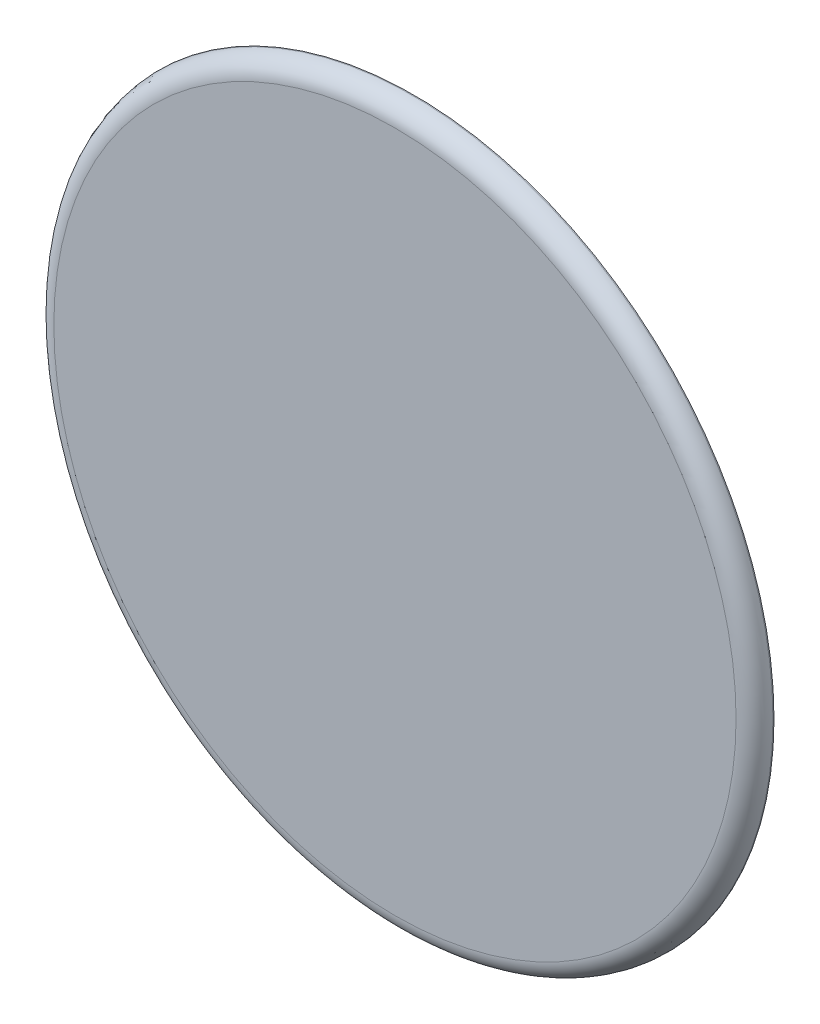
from build123d import *

# Parameters (mm, degrees)
SKETCH1_R           = 190
BOSS_EXTRUDE1_DEPTH = 10
BOSS_EXTRUDE1_TAPER = 3
FILLET1_R           = 10


with BuildPart() as part:
    # Sketch1 → Boss-Extrude1 (new body)
    with BuildSketch(Plane.XY):
        Circle(SKETCH1_R)
    extrude(amount=BOSS_EXTRUDE1_DEPTH, taper=BOSS_EXTRUDE1_TAPER)

    # Fillet1
    fillet1_edges = [part.edges().sort_by_distance(p)[0] for p in [
        (-189.475922207, 0, 10),
    ]]
    fillet(fillet1_edges, radius=FILLET1_R)


solid = part.part
